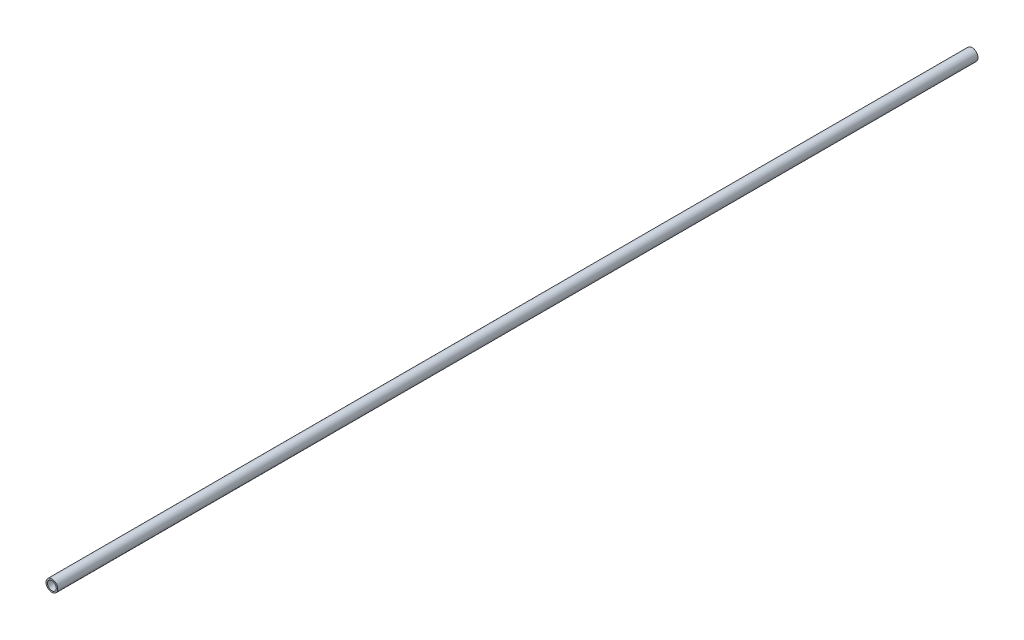
from build123d import *

# Parameters (mm, degrees)
SKETCH1_R           = 40
SKETCH1_R_2         = 30
EXTRUDE_THIN1_DEPTH = 6270


with BuildPart() as part:
    # Sketch1 → Extrude-Thin1 (new body)
    with BuildSketch(Plane.XY):
        Circle(SKETCH1_R)
        Circle(SKETCH1_R_2, mode=Mode.SUBTRACT)
    extrude(amount=EXTRUDE_THIN1_DEPTH)


solid = part.part
